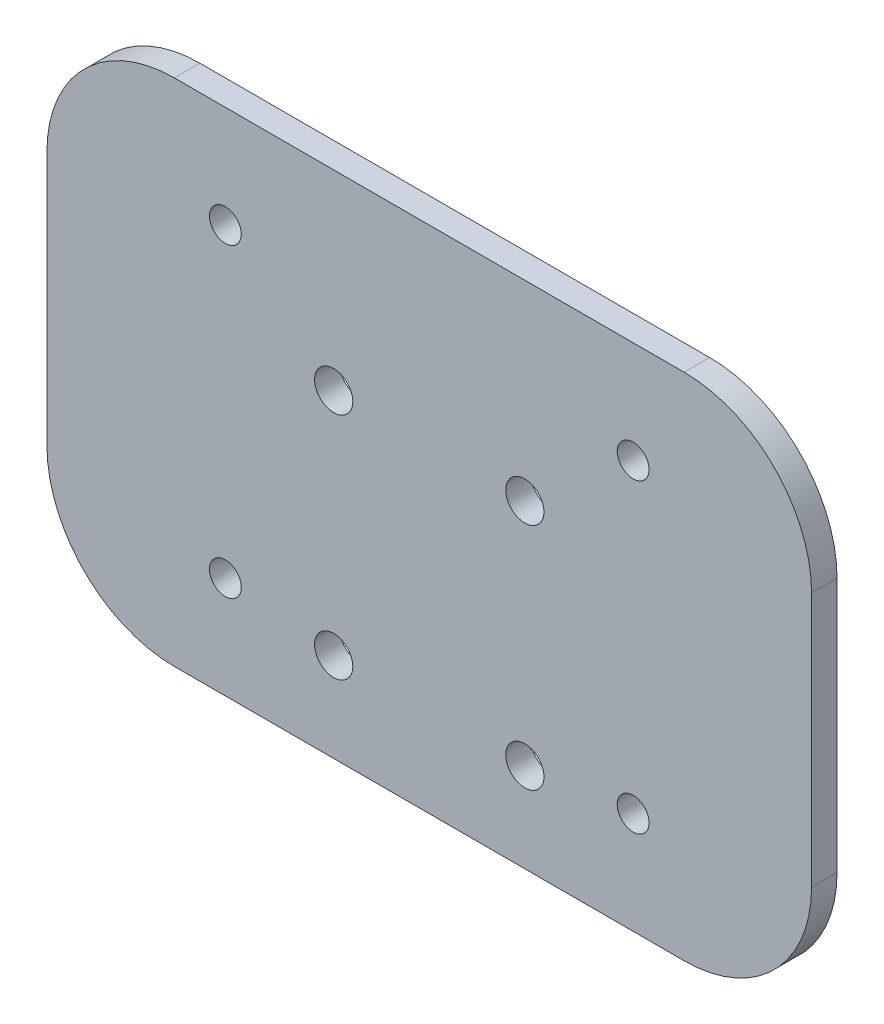
from build123d import *

# Parameters (mm, degrees)
SKETCH_1_W          = 60
SKETCH_1_H          = 40
SKETCH_1_R          = 1.25
EXTRUDE_1_DEPTH     = 2
FILLET_1_R          = 10
SKETCH_2_R          = 1.5
CUT_EXTRUDE_1_DEPTH = 2


with BuildPart() as part:
    # 草图1 → 凸台-拉伸1 (new body)
    with BuildSketch(Plane.XY):
        Rectangle(SKETCH_1_W, SKETCH_1_H)
        with Locations((-16, 12)):
            Circle(SKETCH_1_R, mode=Mode.SUBTRACT)
        with Locations((16, 12)):
            Circle(SKETCH_1_R, mode=Mode.SUBTRACT)
        with Locations((16, -12)):
            Circle(SKETCH_1_R, mode=Mode.SUBTRACT)
        with Locations((-16, -12)):
            Circle(SKETCH_1_R, mode=Mode.SUBTRACT)
    extrude(amount=EXTRUDE_1_DEPTH)

    # 圆角1
    fillet_1_edges = [part.edges().sort_by_distance(p)[0] for p in [
        (30, -20, 1),
        (-30, -20, 1),
        (-30, 20, 1),
        (30, 20, 1),
    ]]
    fillet(fillet_1_edges, radius=FILLET_1_R)

    # 草图2 → 切除-拉伸1 (cut)
    with BuildSketch(Plane.XY.offset(2)):
        with Locations((-7.5, 5)):
            Circle(SKETCH_2_R)
        with Locations((7.5, 5)):
            Circle(SKETCH_2_R)
        with Locations((7.5, -13)):
            Circle(SKETCH_2_R)
        with Locations((-7.5, -13)):
            Circle(SKETCH_2_R)
    extrude(amount=-CUT_EXTRUDE_1_DEPTH, mode=Mode.SUBTRACT)


solid = part.part
